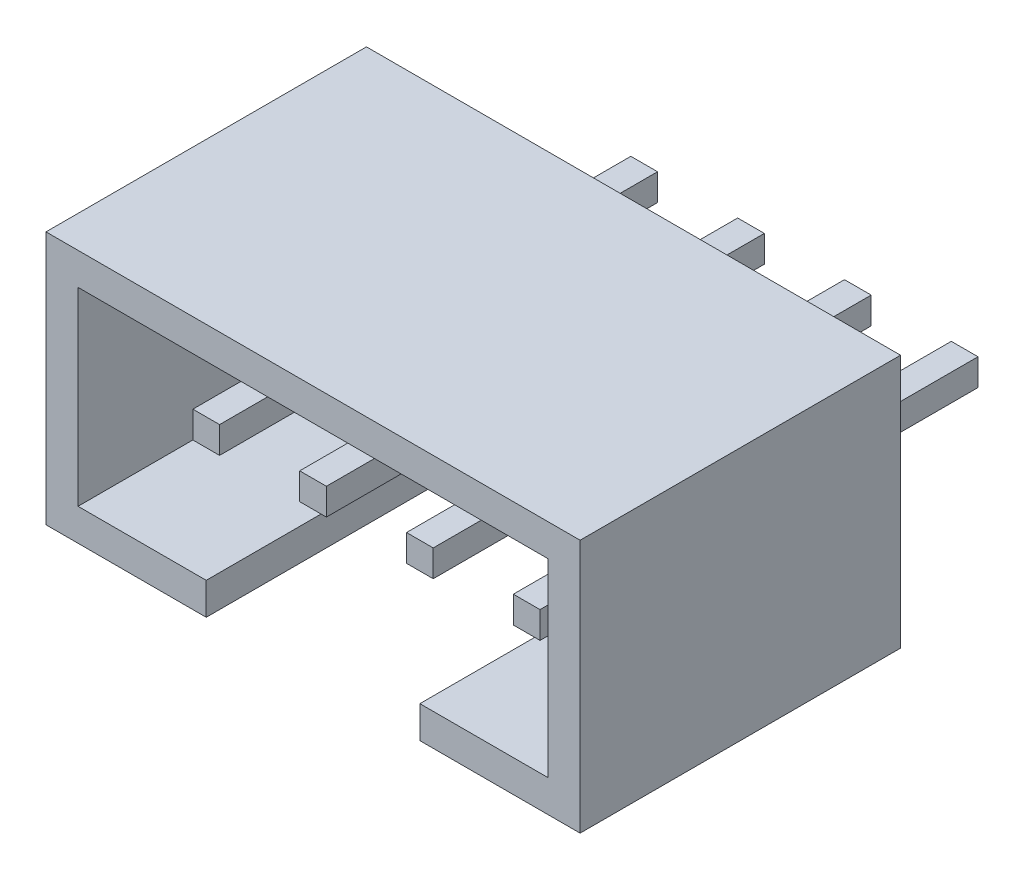
from build123d import *

# Parameters (mm, degrees)
SKETCH1_W           = 10
SKETCH1_H           = 4.75
BOSS_EXTRUDE1_DEPTH = 1.8
BOSS_EXTRUDE2_DEPTH = 4.2
BOSS_EXTRUDE3_START = -5
SKETCH3_W           = 0.5
SKETCH3_H           = 0.5
BOSS_EXTRUDE3_DEPTH = 8.2
LPATTERN1_COUNT     = 4
LPATTERN1_PITCH     = 2


with BuildPart() as part:
    # Sketch1 → Boss-Extrude1 (new body)
    with BuildSketch(Plane.XY):
        Rectangle(SKETCH1_W, SKETCH1_H)
    extrude(amount=BOSS_EXTRUDE1_DEPTH)

    # Sketch2 → Boss-Extrude2 (add)
    with BuildSketch(Plane.XY.offset(1.8)):
        Polygon((-2, -2.375), (-2, -1.775), (-4.4, -1.775), (-4.4, 1.775), (4.4, 1.775), (4.4, -1.775), (2, -1.775), (2, -2.375), (5, -2.375), (5, 2.375), (-5, 2.375), (-5, -2.375), align=None)
    extrude(amount=BOSS_EXTRUDE2_DEPTH)

    # Sketch3 → Boss-Extrude3 (add)
    with BuildSketch(Plane.XY.offset(1.8).offset(BOSS_EXTRUDE3_START)):
        with Locations((-3, -0.375)):
            Rectangle(SKETCH3_W, SKETCH3_H)
    boss_extrude3 = extrude(amount=BOSS_EXTRUDE3_DEPTH)

    # LPattern1: Boss-Extrude3 ×4
    with Locations(*[(i * LPATTERN1_PITCH, 0, 0) for i in range(1, LPATTERN1_COUNT)]):
        add(boss_extrude3)


solid = part.part
